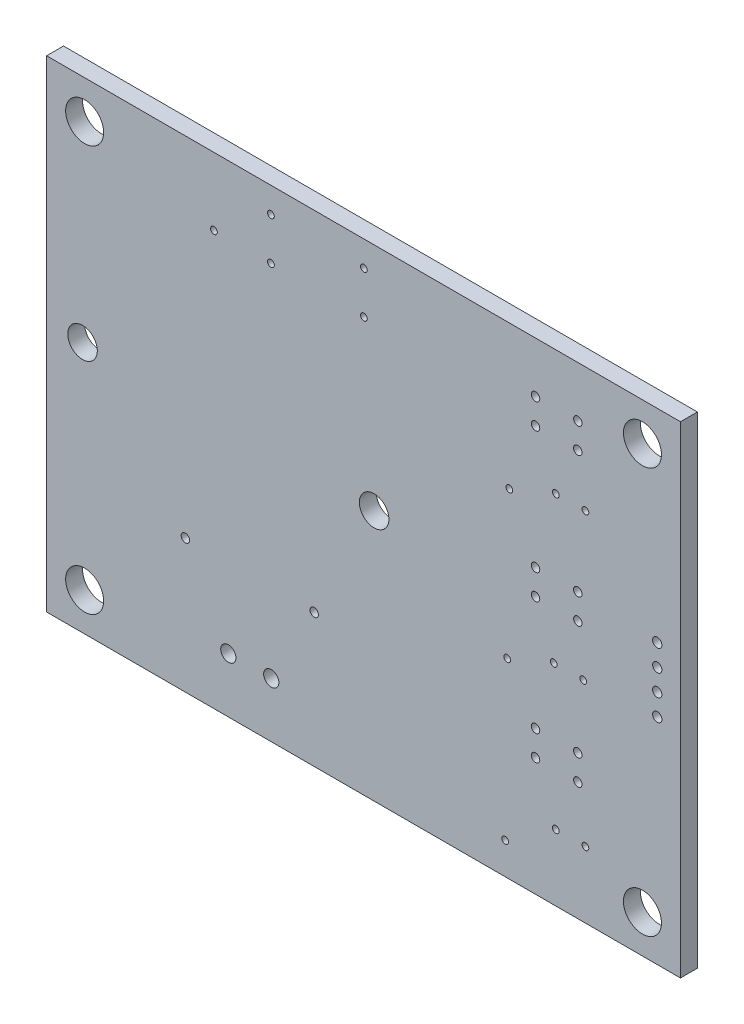
from build123d import *

# Parameters (mm, degrees)
SKETCH_1_W          = 75
SKETCH_1_H          = 57
SKETCH_1_R          = 2.25
SKETCH_1_R_2        = 0.9
SKETCH_1_R_3        = 0.55
SKETCH_1_R_4        = 0.5
SKETCH_1_R_5        = 1.75
EXTRUDE_1_DEPTH     = 2
SKETCH_2_R          = 0.4
CUT_EXTRUDE_1_DEPTH = 2
SKETCH_3_R          = 0.5
CUT_EXTRUDE_2_DEPTH = 2


with BuildPart() as part:
    # Эскиз1 → Вытянуть1 (new body)
    with BuildSketch(Plane.XY):
        Rectangle(SKETCH_1_W, SKETCH_1_H)
        with Locations((-33, 24)):
            Circle(SKETCH_1_R, mode=Mode.SUBTRACT)
        with Locations(Location((33, 24, 0), (0, 0, 180))):
            Circle(SKETCH_1_R, mode=Mode.SUBTRACT)
        with Locations((33, -24)):
            Circle(SKETCH_1_R, mode=Mode.SUBTRACT)
        with Locations(Location((-33, -24, 0), (0, 0, 180))):
            Circle(SKETCH_1_R, mode=Mode.SUBTRACT)
        with Locations((-16, -22)):
            Circle(SKETCH_1_R_2, mode=Mode.SUBTRACT)
        with Locations((-10.92, -22)):
            Circle(SKETCH_1_R_2, mode=Mode.SUBTRACT)
        with Locations((34.75, -3.12)):
            Circle(SKETCH_1_R_3, mode=Mode.SUBTRACT)
        with Locations((34.75, -0.58)):
            Circle(SKETCH_1_R_3, mode=Mode.SUBTRACT)
        with Locations((34.75, 1.96)):
            Circle(SKETCH_1_R_3, mode=Mode.SUBTRACT)
        with Locations((34.75, 4.5)):
            Circle(SKETCH_1_R_3, mode=Mode.SUBTRACT)
        with Locations((-5.84, -12.7)):
            Circle(SKETCH_1_R_4, mode=Mode.SUBTRACT)
        with Locations((-21.08, -12.7)):
            Circle(SKETCH_1_R_4, mode=Mode.SUBTRACT)
        with Locations((-33.25, 1.25)):
            Circle(SKETCH_1_R_5, mode=Mode.SUBTRACT)
        with Locations((1.25, 1.25)):
            Circle(SKETCH_1_R_5, mode=Mode.SUBTRACT)
    extrude(amount=EXTRUDE_1_DEPTH)

    # Эскиз2 → Вырез-Вытянуть1 (cut)
    with BuildSketch(Plane.XY.offset(2)):
        with Locations((-17.7, 20.5)):
            Circle(SKETCH_2_R)
        with Locations((16.75, -24.75)):
            Circle(SKETCH_2_R)
        with Locations((17, -6)):
            Circle(SKETCH_2_R)
        with Locations((17.25, 11.5)):
            Circle(SKETCH_2_R)
        with Locations((-10.96, 20.5)):
            Circle(SKETCH_2_R)
        with Locations((0.04, 20.5)):
            Circle(SKETCH_2_R)
        with Locations((-10.96, 25.5)):
            Circle(SKETCH_2_R)
        with Locations((0.04, 25.5)):
            Circle(SKETCH_2_R)
        with Locations((22.75, -20.65)):
            Circle(SKETCH_2_R)
        with Locations((26.25, -20.65)):
            Circle(SKETCH_2_R)
        with Locations((22.5, -3.72)):
            Circle(SKETCH_2_R)
        with Locations((26, -3.72)):
            Circle(SKETCH_2_R)
        with Locations((22.75, 13.75)):
            Circle(SKETCH_2_R)
        with Locations((26.25, 13.75)):
            Circle(SKETCH_2_R)
    extrude(amount=-CUT_EXTRUDE_1_DEPTH, mode=Mode.SUBTRACT)

    # Эскиз3 → Вырез-Вытянуть2 (cut)
    with BuildSketch(Plane.XY.offset(2)):
        with Locations((20.35, 19.5)):
            Circle(SKETCH_3_R)
        with Locations((25.35, 19.5)):
            Circle(SKETCH_3_R)
        with Locations((25.35, 22.5)):
            Circle(SKETCH_3_R)
        with Locations((20.35, 22.5)):
            Circle(SKETCH_3_R)
        with Locations((20.35, 2)):
            Circle(SKETCH_3_R)
        with Locations((25.35, 2)):
            Circle(SKETCH_3_R)
        with Locations((25.35, 5)):
            Circle(SKETCH_3_R)
        with Locations((20.35, 5)):
            Circle(SKETCH_3_R)
        with Locations((20.35, -14.5)):
            Circle(SKETCH_3_R)
        with Locations((25.35, -14.5)):
            Circle(SKETCH_3_R)
        with Locations((25.35, -11.5)):
            Circle(SKETCH_3_R)
        with Locations((20.35, -11.5)):
            Circle(SKETCH_3_R)
    extrude(amount=-CUT_EXTRUDE_2_DEPTH, mode=Mode.SUBTRACT)


solid = part.part
